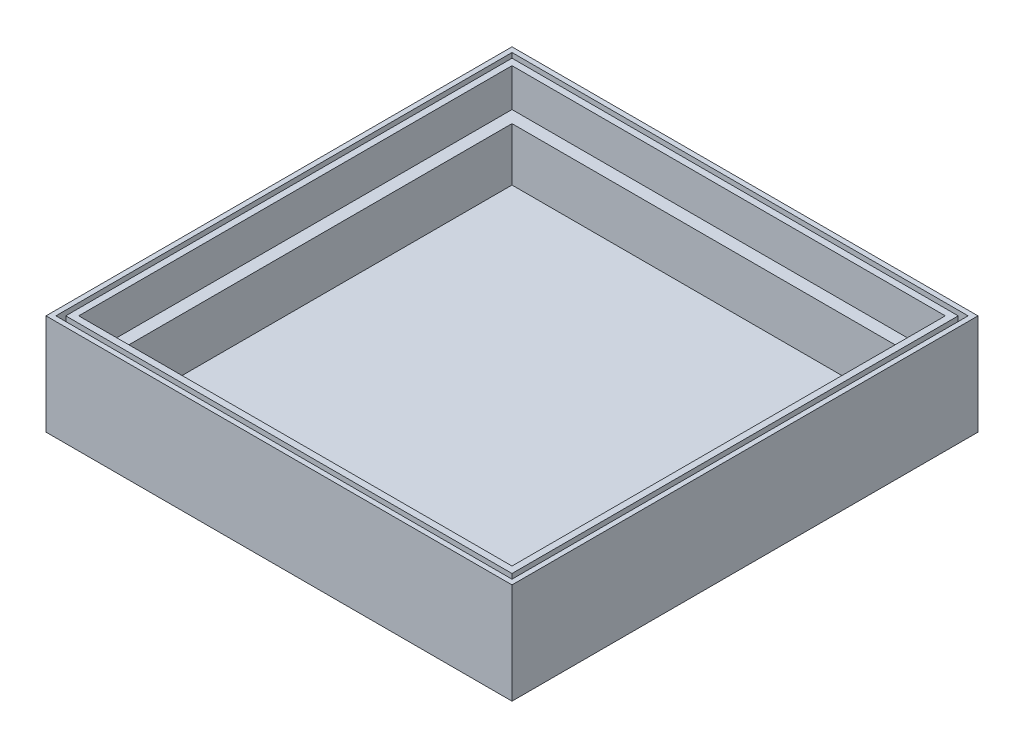
from build123d import *

# Parameters (mm, degrees)
SKETCH2_W           = 311.404
SKETCH2_H           = 311.404
BOSS_EXTRUDE1_DEPTH = 67.31
SKETCH4_W           = 289.56
SKETCH4_H           = 289.56
CUT_EXTRUDE1_DEPTH  = 25.4
SKETCH5_W           = 273.304
SKETCH5_H           = 273.304
CUT_EXTRUDE2_DEPTH  = 60.96
SKETCH6_W           = 304.8
SKETCH6_H           = 304.8
SKETCH6_W_2         = 298.196
SKETCH6_H_2         = 298.196
CUT_EXTRUDE3_DEPTH  = 12.7


with BuildPart() as part:
    # Sketch2 → Boss-Extrude1 (new body)
    with BuildSketch(Plane(origin=(0, 0, 0), x_dir=(1, 0, 0), z_dir=(0, 1, 0))):
        Rectangle(SKETCH2_W, SKETCH2_H)
    extrude(amount=BOSS_EXTRUDE1_DEPTH)

    # Sketch4 → Cut-Extrude1 (cut)
    with BuildSketch(Plane(origin=(0, 67.31, 0), x_dir=(1, 0, 0), z_dir=(0, 1, 0))):
        Rectangle(SKETCH4_W, SKETCH4_H)
    extrude(amount=-CUT_EXTRUDE1_DEPTH, mode=Mode.SUBTRACT)

    # Sketch5 → Cut-Extrude2 (cut)
    with BuildSketch(Plane(origin=(0, 67.31, 0), x_dir=(1, 0, 0), z_dir=(0, 1, 0))):
        Rectangle(SKETCH5_W, SKETCH5_H)
    extrude(amount=-CUT_EXTRUDE2_DEPTH, mode=Mode.SUBTRACT)

    # Sketch6 → Cut-Extrude3 (cut)
    with BuildSketch(Plane(origin=(0, 67.31, 0), x_dir=(1, 0, 0), z_dir=(0, 1, 0))):
        Rectangle(SKETCH6_W, SKETCH6_H)
        Rectangle(SKETCH6_W_2, SKETCH6_H_2, mode=Mode.SUBTRACT)
    extrude(amount=-CUT_EXTRUDE3_DEPTH, mode=Mode.SUBTRACT)


solid = part.part
